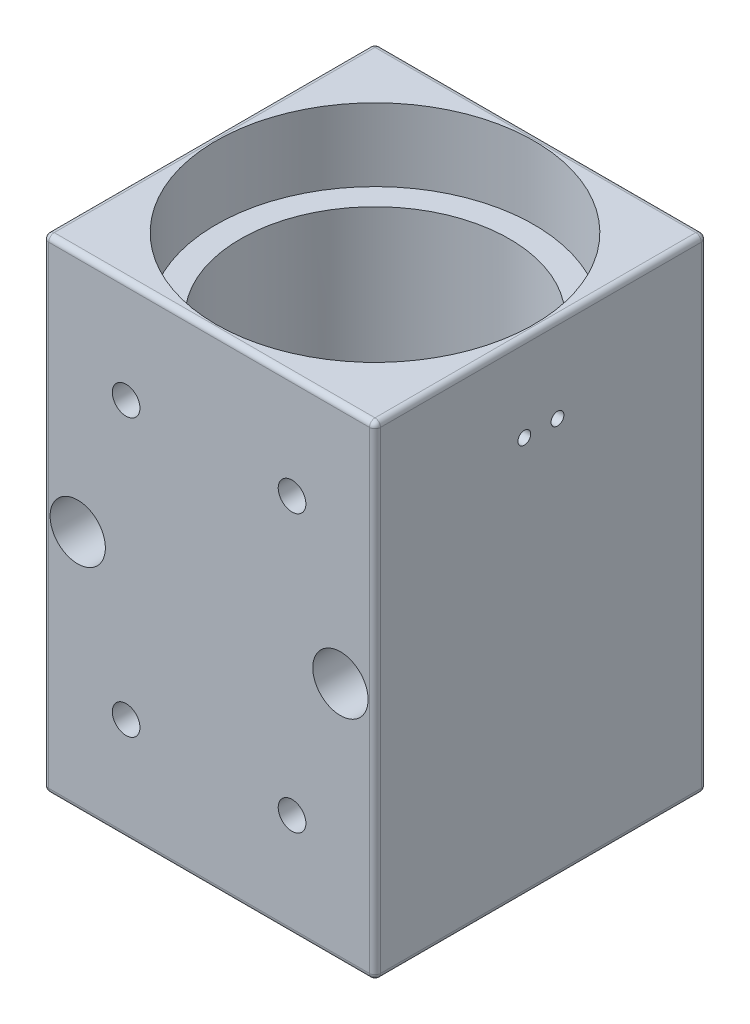
from build123d import *

# Parameters (mm, degrees)
SKETCH1_W           = 76.2
SKETCH1_H           = 111.125
BOSS_EXTRUDE1_DEPTH = 76.2
SKETCH2_R           = 30.861
CUT_EXTRUDE1_DEPTH  = 127
SKETCH3_R           = 36.5125
CUT_EXTRUDE2_DEPTH  = 16.66875
CUT_EXTRUDE3_START  = -16.66875
SKETCH4_R           = 36.5125
CUT_EXTRUDE3_DEPTH  = 16.66875
SKETCH5_R           = 6.35
CUT_EXTRUDE4_DEPTH  = 102.711559846
CUT_EXTRUDE5_DEPTH  = 12.7
FILLET1_R           = 1.27
SKETCH8_R           = 1.4732
CUT_EXTRUDE6_DEPTH  = 23.622


with BuildPart() as part:
    # Sketch1 → Boss-Extrude1 (new body)
    with BuildSketch(Plane.XY):
        Rectangle(SKETCH1_W, SKETCH1_H)
    extrude(amount=BOSS_EXTRUDE1_DEPTH)

    # Sketch2 → Cut-Extrude1 (cut)
    with BuildSketch(Plane(origin=(0, 55.5625, 0), x_dir=(1, 0, 0), z_dir=(0, 1, 0))):
        with Locations(Location((0, -38.1, 0), (0, 0, 270))):
            Circle(SKETCH2_R)
    extrude(amount=-CUT_EXTRUDE1_DEPTH, mode=Mode.SUBTRACT)

    # Sketch3 → Cut-Extrude2 (cut)
    with BuildSketch(Plane(origin=(0, 55.5625, 0), x_dir=(1, 0, 0), z_dir=(0, 1, 0))):
        with Locations(Location((0, -38.1, 0), (0, 0, 270))):
            Circle(SKETCH3_R)
    extrude(amount=-CUT_EXTRUDE2_DEPTH, mode=Mode.SUBTRACT)

    # Sketch4 → Cut-Extrude3 (cut)
    with BuildSketch(Plane.XZ.offset(55.5625).offset(CUT_EXTRUDE3_START)):
        with Locations(Location((0, 38.1, 0), (0, 0, 90))):
            Circle(SKETCH4_R)
    extrude(amount=CUT_EXTRUDE3_DEPTH, mode=Mode.SUBTRACT)

    # Sketch5 → Cut-Extrude4 (cut, through all)
    with BuildSketch(Plane.XY.offset(76.2)):
        with Locations((-30.1625, 0)):
            Circle(SKETCH5_R)
        with Locations((30.1625, 0)):
            Circle(SKETCH5_R)
    extrude(amount=-CUT_EXTRUDE4_DEPTH, mode=Mode.SUBTRACT)

    # Sketch6 → Cut-Extrude5 (cut)
    with BuildSketch(Plane.XY.offset(76.2)):
        with BuildLine():
            ThreePointArc((-15.875, 31.75), (-21.29506403, 33.99506403), (-19.05, 28.575))
            Line((-19.05, 28.575), (-19.05, 31.75))
            Line((-19.05, 31.75), (-15.875, 31.75))
        make_face()
        with BuildLine():
            Line((-19.05, 31.75), (-19.05, 28.575))
            ThreePointArc((-19.05, 28.575), (-16.80493597, 29.50493597), (-15.875, 31.75))
            Line((-15.875, 31.75), (-19.05, 31.75))
        make_face()
        with BuildLine():
            ThreePointArc((15.875, 31.75), (16.80493597, 29.50493597), (19.05, 28.575))
            Line((19.05, 28.575), (19.05, 31.75))
            Line((19.05, 31.75), (15.875, 31.75))
        make_face()
        with BuildLine():
            Line((19.05, 31.75), (19.05, 28.575))
            ThreePointArc((19.05, 28.575), (21.29506403, 29.50493597), (22.225, 31.75))
            ThreePointArc((22.225, 31.75), (19.05, 34.925), (15.875, 31.75))
            Line((15.875, 31.75), (19.05, 31.75))
        make_face()
        with BuildLine():
            ThreePointArc((-19.05, -28.575), (-21.29506403, -33.99506403), (-15.875, -31.75))
            Line((-15.875, -31.75), (-19.05, -31.75))
            Line((-19.05, -31.75), (-19.05, -28.575))
        make_face()
        with BuildLine():
            Line((-19.05, -31.75), (-15.875, -31.75))
            ThreePointArc((-15.875, -31.75), (-16.80493597, -29.50493597), (-19.05, -28.575))
            Line((-19.05, -28.575), (-19.05, -31.75))
        make_face()
        with BuildLine():
            ThreePointArc((19.05, -28.575), (16.80493597, -29.50493597), (15.875, -31.75))
            Line((15.875, -31.75), (19.05, -31.75))
            Line((19.05, -31.75), (19.05, -28.575))
        make_face()
        with BuildLine():
            Line((19.05, -31.75), (15.875, -31.75))
            ThreePointArc((15.875, -31.75), (19.05, -34.925), (22.225, -31.75))
            ThreePointArc((22.225, -31.75), (21.29506403, -29.50493597), (19.05, -28.575))
            Line((19.05, -28.575), (19.05, -31.75))
        make_face()
    extrude(amount=-CUT_EXTRUDE5_DEPTH, mode=Mode.SUBTRACT)

    # Fillet1
    fillet1_edges = [part.edges().sort_by_distance(p)[0] for p in [
        (-38.1, 0, 76.2),
        (0, -55.5625, 76.2),
        (38.1, 0, 76.2),
        (0, -55.5625, 0),
        (-38.1, 0, 0),
        (0, 55.5625, 0),
        (38.1, 0, 0),
        (0, 55.5625, 76.2),
        (38.1, -55.5625, 38.1),
        (-38.1, -55.5625, 38.1),
        (-38.1, 55.5625, 38.1),
        (38.1, 55.5625, 38.1),
    ]]
    fillet(fillet1_edges, radius=FILLET1_R)

    # Sketch8 → Cut-Extrude6 (cut)
    with BuildSketch(Plane.ZY.offset(-38.1)):
        with Locations(Location((34.29, 35.71875, 0), (0, 0, 180))):
            Circle(SKETCH8_R)
        with Locations(Location((41.91, 35.71875, 0), (0, 0, 180))):
            Circle(SKETCH8_R)
    extrude(amount=CUT_EXTRUDE6_DEPTH, mode=Mode.SUBTRACT)


solid = part.part
